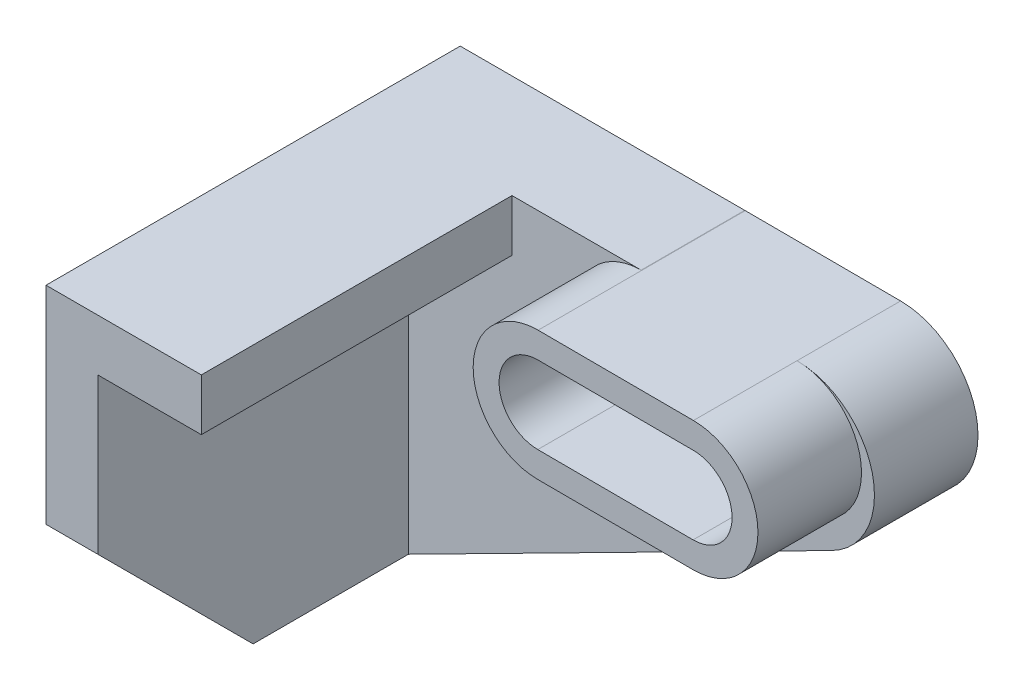
from build123d import *

# Parameters (mm, degrees)
EXTRUDE_4_DEPTH     = 20
EXTRUDE_5_DEPTH     = 80
CUT_EXTRUDE_2_DEPTH = 80
EXTRUDE_6_DEPTH     = 40


with BuildPart() as part:
    # 草圖1 → 填料-伸長4 (new body)
    with BuildSketch(Plane.XY):
        with BuildLine():
            Line((0.052876053, 14.999906804), (-29.946937555, 15.10565891))
            Line((-29.946937555, 15.10565891), (-55, 15.10565891))
            Line((-55, 15.10565891), (-55, 5.10565891))
            Line((-55, 5.10565891), (-75, 5.10565891))
            Line((-75, 5.10565891), (-75, -54.89434109))
            Line((-75, -54.89434109), (6.789733995, -13.37533223))
            ThreePointArc((6.789733995, -13.37533223), (14.5943097, 3.464985479), (0.052876053, 14.999906804))
        make_face()
    extrude(amount=EXTRUDE_4_DEPTH)

    # 草圖3 → 填料-伸長5 (add)
    with BuildSketch(Plane.XY):
        Polygon((-55, 15.10565891), (-85, 15.10565891), (-85, -54.89434109), (-75, -54.89434109), (-75, 5.10565891), (-55, 5.10565891), align=None)
    extrude(amount=EXTRUDE_5_DEPTH)

    # 草圖4 → 除料-伸長2 (cut)
    with BuildSketch(Plane(origin=(-75, 0, 0), x_dir=(0, 0, -1), z_dir=(1, 0, 0))):
        Polygon((-80, -24.89434109), (-50, -54.89434109), (-80, -54.89434109), align=None)
    extrude(amount=-CUT_EXTRUDE_2_DEPTH, mode=Mode.SUBTRACT)

    # 草圖5 → 填料-伸長6 (add)
    with BuildSketch(Plane.XY):
        with BuildLine():
            Line((-0.044063377, -9.999906804), (-30.044063377, -9.894154041))
            ThreePointArc((-30.044063377, -9.894154041), (-42.499922337, 2.649831673), (-29.955936623, 15.105690632))
            Line((-29.955936623, 15.105690632), (0.044063377, 14.999937869))
            ThreePointArc((0.044063377, 14.999937869), (12.499922337, 2.455952155), (-0.044063377, -9.999906804))
        make_face()
        with BuildLine():
            Line((-0.026438026, -4.999937869), (-30.026438026, -4.894185106))
            ThreePointArc((-30.026438026, -4.894185106), (-37.499953402, 2.632206322), (-29.973561974, 10.105721698))
            Line((-29.973561974, 10.105721698), (0.026438026, 9.999968935))
            ThreePointArc((0.026438026, 9.999968935), (7.499953402, 2.473577506), (-0.026438026, -4.999937869))
        make_face(mode=Mode.SUBTRACT)
    extrude(amount=EXTRUDE_6_DEPTH)


solid = part.part
